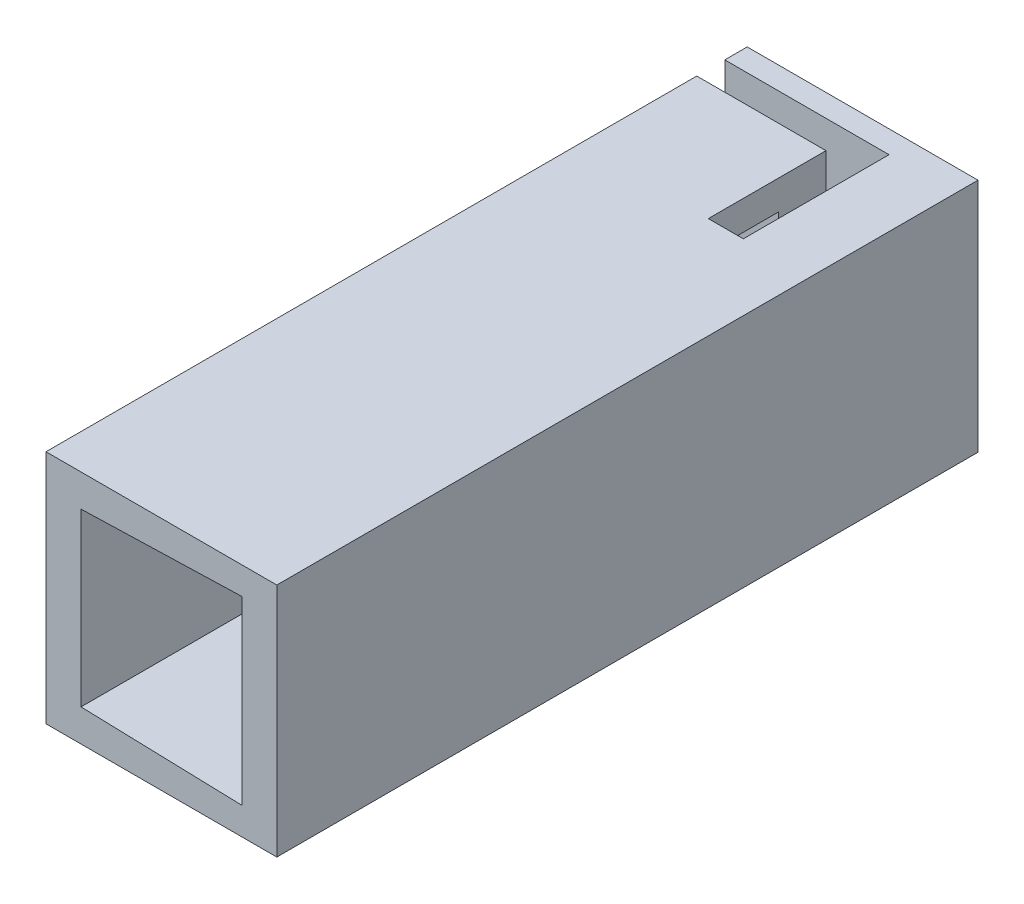
from build123d import *

# Parameters (mm, degrees)
SKETCH2_W               = 32.95
SKETCH2_H               = 33.638015847
BOSS_EXTRUDE1_DEPTH     = 86.1
SKETCH4_W               = 32.95
SKETCH4_H               = 14
BOSS_EXTRUDE3_DEPTH     = 33.63802
CUT_EXTRUDE1_DEPTH      = 27.1
CUT_EXTRUDE1_DEPTH_BACK = 6
CUT_EXTRUDE1_START      = -16.819008
SKETCH5_W               = 5
SKETCH5_H               = 6.8
CUT_EXTRUDE2_REACH      = 100.135
SKETCH6_W               = 5
SKETCH6_H               = 10


with BuildPart() as part:
    # Sketch2 → Boss-Extrude1 (new body)
    with BuildSketch(Plane.XY):
        with Locations((-16.475, 16.819007924)):
            Rectangle(SKETCH2_W, SKETCH2_H)
        Polygon((-5, 3.909007924), (-5, 29.729007924), (-27.95, 29.044167374), (-27.95, 4.593848474), align=None, mode=Mode.SUBTRACT)
    extrude(amount=BOSS_EXTRUDE1_DEPTH)


with BuildPart() as body_2:
    # Sketch4 → Boss-Extrude3 (new body)
    with BuildSketch(Plane(origin=(0, 0, 0), x_dir=(1, 0, 0), z_dir=(0, 1, 0))):
        with Locations((-16.475, 7)):
            Rectangle(SKETCH4_W, SKETCH4_H)
    extrude(amount=BOSS_EXTRUDE3_DEPTH)

    # Sketch5 → Cut-Extrude1 (cut, two sides: drawn at the far end of the back side and taken through both)
    with BuildSketch(Plane(origin=(0, 33.638015847, 0), x_dir=(1, 0, 0), z_dir=(0, 1, 0)).offset(CUT_EXTRUDE1_START - CUT_EXTRUDE1_DEPTH_BACK)):
        with Locations((-12, 3.4)):
            Rectangle(SKETCH5_W, SKETCH5_H)
        Polygon((-14.5, 6.8), (-9.5, 6.8), (-9.5, 7.05), (-9.5, 10.8), (-32.95, 10.8), (-32.95, 6.8), align=None)
    extrude(amount=CUT_EXTRUDE1_DEPTH + CUT_EXTRUDE1_DEPTH_BACK, mode=Mode.SUBTRACT)


with BuildPart() as part_1:
    add(part.part)

    # Combine1: union body 2
    add(body_2.part)

    # Cut-Extrude2: up to this plane
    cut_extrude2_end = Plane(origin=(-27.95, 29.044167374, 86.1), z_dir=(0.029827269826923603, -0.9995550680050959, 0))
    # Sketch6 → Cut-Extrude2 (cut, up to the surface)
    with BuildSketch(Plane(origin=(0, 33.638015847, 0), x_dir=(1, 0, 0), z_dir=(0, 1, 0)), mode=Mode.PRIVATE) as cut_extrude2_sk1:
        with Locations((-12, -5)):
            Rectangle(SKETCH6_W, SKETCH6_H)
    cut_extrude2_tool1 = split(extrude(cut_extrude2_sk1.sketch, amount=-CUT_EXTRUDE2_REACH, mode=Mode.PRIVATE), bisect_by=cut_extrude2_end, keep=Keep.BOTH, mode=Mode.PRIVATE)
    add(cut_extrude2_tool1.solids().sort_by_distance((-12, 33.638016, 5))[0], mode=Mode.SUBTRACT)


solid = part_1.part
